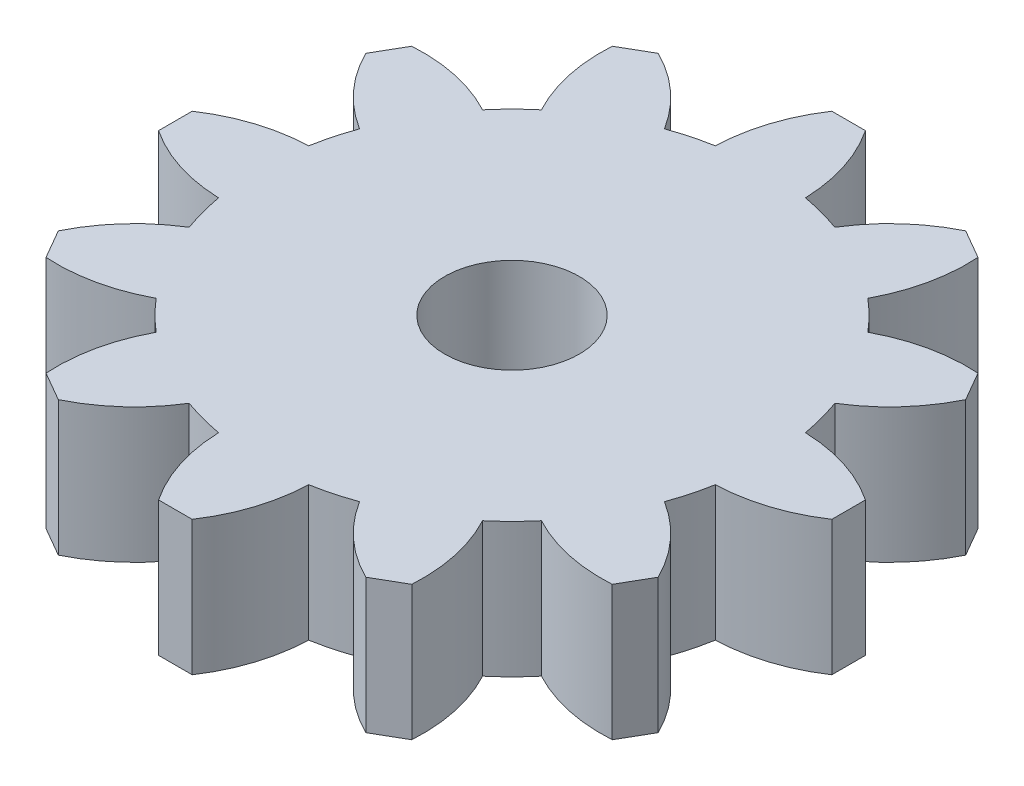
from build123d import *

# Parameters (mm, degrees)
SKETCH1_R           = 4
BOSS_EXTRUDE1_DEPTH = 8


with BuildPart() as part:
    # Sketch1 → Boss-Extrude1 (new body)
    with BuildSketch(Plane(origin=(0, 0, 0), x_dir=(1, 0, 0), z_dir=(0, 1, 0))):
        with BuildLine():
            Line((-1, 20), (1, 20))
            ThreePointArc((1, 20), (2.204975942, 17.497232023), (2.675, 14.759551992))
            ThreePointArc((2.675, 14.759551992), (3.882285677, 14.488887394), (5.063158041, 14.119646973))
            ThreePointArc((5.063158041, 14.119646973), (6.839050831, 16.255535399), (9.133974596, 17.820508076))
            Line((9.133974596, 17.820508076), (10.866025404, 16.820508076))
            ThreePointArc((10.866025404, 16.820508076), (10.658181192, 14.050559457), (9.696393951, 11.444646973))
            ThreePointArc((9.696393951, 11.444646973), (10.606601718, 10.606601718), (11.444646973, 9.696393951))
            ThreePointArc((11.444646973, 9.696393951), (14.050559457, 10.658181192), (16.820508076, 10.866025404))
            Line((16.820508076, 10.866025404), (17.820508076, 9.133974596))
            ThreePointArc((17.820508076, 9.133974596), (16.255535399, 6.839050831), (14.119646973, 5.063158041))
            ThreePointArc((14.119646973, 5.063158041), (14.488887394, 3.882285677), (14.759551992, 2.675))
            ThreePointArc((14.759551992, 2.675), (17.497232023, 2.204975942), (20, 1))
            Line((20, 1), (20, -1))
            ThreePointArc((20, -1), (17.497232023, -2.204975942), (14.759551992, -2.675))
            ThreePointArc((14.759551992, -2.675), (14.488887394, -3.882285677), (14.119646973, -5.063158041))
            ThreePointArc((14.119646973, -5.063158041), (16.255535399, -6.839050831), (17.820508076, -9.133974596))
            Line((17.820508076, -9.133974596), (16.820508076, -10.866025404))
            ThreePointArc((16.820508076, -10.866025404), (14.050559457, -10.658181192), (11.444646973, -9.696393951))
            ThreePointArc((11.444646973, -9.696393951), (10.606601718, -10.606601718), (9.696393951, -11.444646973))
            ThreePointArc((9.696393951, -11.444646973), (10.658181192, -14.050559457), (10.866025404, -16.820508076))
            Line((10.866025404, -16.820508076), (9.133974596, -17.820508076))
            ThreePointArc((9.133974596, -17.820508076), (6.839050831, -16.255535399), (5.063158041, -14.119646973))
            ThreePointArc((5.063158041, -14.119646973), (3.882285677, -14.488887394), (2.675, -14.759551992))
            ThreePointArc((2.675, -14.759551992), (2.204975942, -17.497232023), (1, -20))
            Line((1, -20), (-1, -20))
            ThreePointArc((-1, -20), (-2.204975942, -17.497232023), (-2.675, -14.759551992))
            ThreePointArc((-2.675, -14.759551992), (-3.882285677, -14.488887394), (-5.063158041, -14.119646973))
            ThreePointArc((-5.063158041, -14.119646973), (-6.839050831, -16.255535399), (-9.133974596, -17.820508076))
            Line((-9.133974596, -17.820508076), (-10.866025404, -16.820508076))
            ThreePointArc((-10.866025404, -16.820508076), (-10.658181192, -14.050559457), (-9.696393951, -11.444646973))
            ThreePointArc((-9.696393951, -11.444646973), (-10.606601718, -10.606601718), (-11.444646973, -9.696393951))
            ThreePointArc((-11.444646973, -9.696393951), (-14.050559457, -10.658181192), (-16.820508076, -10.866025404))
            Line((-16.820508076, -10.866025404), (-17.820508076, -9.133974596))
            ThreePointArc((-17.820508076, -9.133974596), (-16.255535399, -6.839050831), (-14.119646973, -5.063158041))
            ThreePointArc((-14.119646973, -5.063158041), (-14.488887394, -3.882285677), (-14.759551992, -2.675))
            ThreePointArc((-14.759551992, -2.675), (-17.497232023, -2.204975942), (-20, -1))
            Line((-20, -1), (-20, 1))
            ThreePointArc((-20, 1), (-17.497232023, 2.204975942), (-14.759551992, 2.675))
            ThreePointArc((-14.759551992, 2.675), (-14.488887394, 3.882285677), (-14.119646973, 5.063158041))
            ThreePointArc((-14.119646973, 5.063158041), (-16.255535399, 6.839050831), (-17.820508076, 9.133974596))
            Line((-17.820508076, 9.133974596), (-16.820508076, 10.866025404))
            ThreePointArc((-16.820508076, 10.866025404), (-14.050559457, 10.658181192), (-11.444646973, 9.696393951))
            ThreePointArc((-11.444646973, 9.696393951), (-10.606601718, 10.606601718), (-9.696393951, 11.444646973))
            ThreePointArc((-9.696393951, 11.444646973), (-10.658181192, 14.050559457), (-10.866025404, 16.820508076))
            Line((-10.866025404, 16.820508076), (-9.133974596, 17.820508076))
            ThreePointArc((-9.133974596, 17.820508076), (-6.839050831, 16.255535399), (-5.063158041, 14.119646973))
            ThreePointArc((-5.063158041, 14.119646973), (-3.882285677, 14.488887394), (-2.675, 14.759551992))
            ThreePointArc((-2.675, 14.759551992), (-2.204975942, 17.497232023), (-1, 20))
        make_face()
        with Locations(Location((0, 0, 0), (0, 0, 270))):
            Circle(SKETCH1_R, mode=Mode.SUBTRACT)
    extrude(amount=BOSS_EXTRUDE1_DEPTH)


solid = part.part
